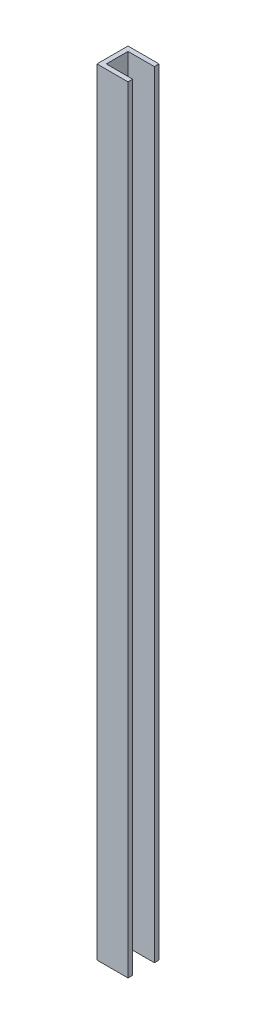
from build123d import *

# Parameters (mm, degrees)
BOSS_EXTRUDE1_DEPTH = 125


with BuildPart() as part:
    # Sketch2 → Boss-Extrude1 (new, symmetric)
    with BuildSketch(Plane(origin=(0, 0, 0), x_dir=(1, 0, 0), z_dir=(0, 1, 0))):
        Polygon((-5, 5), (-5, -5), (5, -5), (5, -3.5), (-3.5, -3.5), (-3.5, 3.5), (5, 3.5), (5, 5), align=None)
    extrude(amount=BOSS_EXTRUDE1_DEPTH, both=True)


solid = part.part
